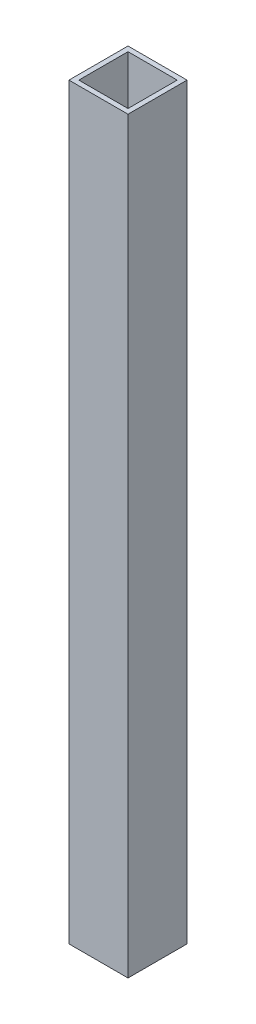
from build123d import *

# Parameters (mm, degrees)
SKETCH1_W           = 19.05
SKETCH1_H           = 19.05
SKETCH1_W_2         = 15.875
SKETCH1_H_2         = 15.875
BOSS_EXTRUDE1_DEPTH = 241.3


with BuildPart() as part:
    # Sketch1 → Boss-Extrude1 (new body)
    with BuildSketch(Plane(origin=(0, 0, 0), x_dir=(1, 0, 0), z_dir=(0, 1, 0))):
        with Locations((9.525, 9.525)):
            Rectangle(SKETCH1_W, SKETCH1_H)
        with Locations((9.525, 9.525)):
            Rectangle(SKETCH1_W_2, SKETCH1_H_2, mode=Mode.SUBTRACT)
    extrude(amount=BOSS_EXTRUDE1_DEPTH)


solid = part.part
